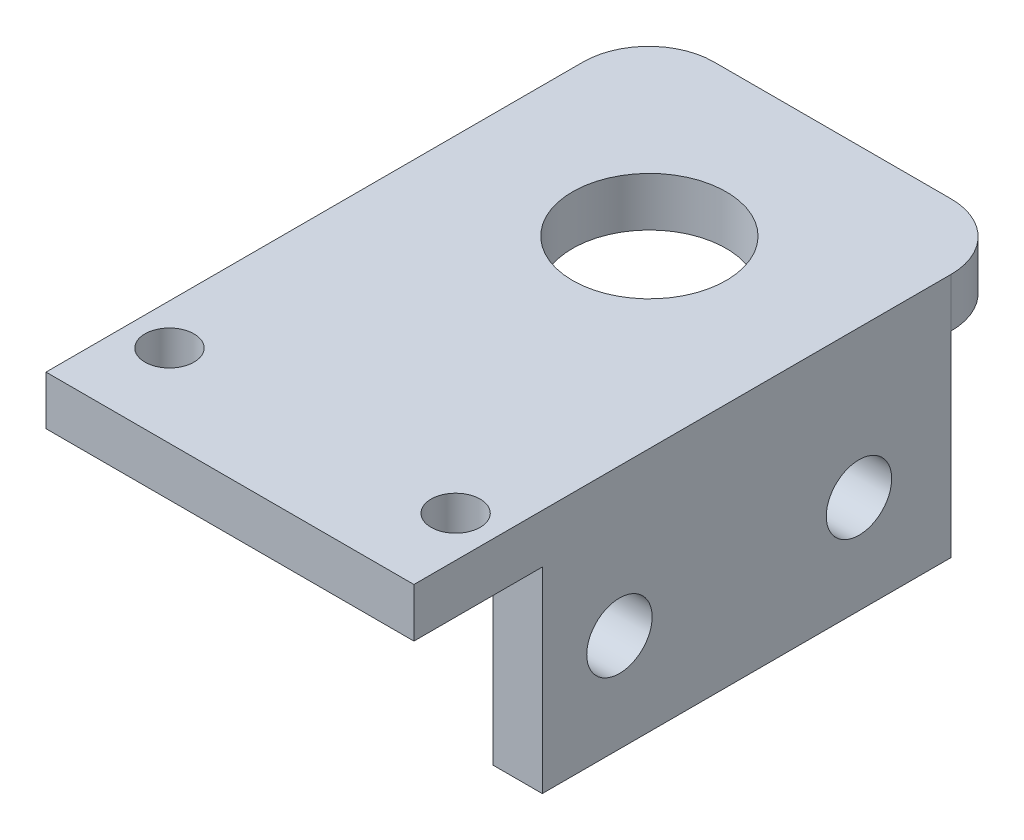
from build123d import *

# Parameters (mm, degrees)
SKETCH1_R           = 1.5
SKETCH1_R_2         = 4.7
BOSS_EXTRUDE1_DEPTH = 3
SKETCH2_W           = 25
SKETCH2_H           = 12
BOSS_EXTRUDE3_DEPTH = 3
SKETCH4_R           = 2
CUT_EXTRUDE2_DEPTH  = 31.33101416
BOSS_EXTRUDE4_DEPTH = 1.5


with BuildPart() as part:
    # Sketch1 → Boss-Extrude1 (new body)
    with BuildSketch(Plane(origin=(0, 0, 0), x_dir=(1, 0, 0), z_dir=(0, 1, 0))):
        with BuildLine():
            ThreePointArc((21.045480929, 12.95727721), (19.873908054, 15.785704335), (17.045480929, 16.95727721))
            Line((17.045480929, 16.95727721), (2.545480929, 16.95727721))
            ThreePointArc((2.545480929, 16.95727721), (-0.282946196, 15.785704335), (-1.454519071, 12.95727721))
            Line((-1.454519071, 12.95727721), (-1.454519071, -19.89272279))
            Line((-1.454519071, -19.89272279), (2.724413117, -19.89272279))
            Line((2.724413117, -19.89272279), (16.866548741, -19.89272279))
            Line((16.866548741, -19.89272279), (21.045480929, -19.89272279))
            Line((21.045480929, -19.89272279), (21.045480929, 12.95727721))
        make_face()
        with Locations(Location((1.045480929, -14.84272279, 0), (0, 0, 270))):
            Circle(SKETCH1_R, mode=Mode.SUBTRACT)
        with Locations(Location((18.545480929, -14.84272279, 0), (0, 0, 270))):
            Circle(SKETCH1_R, mode=Mode.SUBTRACT)
        with Locations(Location((9.795480929, 5.75727721, 0), (0, 0, 270))):
            Circle(SKETCH1_R_2, mode=Mode.SUBTRACT)
    extrude(amount=BOSS_EXTRUDE1_DEPTH)

    # Sketch2 → Boss-Extrude3 (add)
    with BuildSketch(Plane(origin=(21.045480929, 0, 0), x_dir=(0, 0, -1), z_dir=(1, 0, 0))):
        with Locations((0.45727721, -6)):
            Rectangle(SKETCH2_W, SKETCH2_H)
    extrude(amount=-BOSS_EXTRUDE3_DEPTH)

    # Sketch4 → Cut-Extrude2 (cut, through all)
    with BuildSketch(Plane.ZY.offset(-18.045480929)):
        with Locations((7.324019086, -6)):
            Circle(SKETCH4_R)
        with Locations((-7.324019086, -6)):
            Circle(SKETCH4_R)
    extrude(amount=-CUT_EXTRUDE2_DEPTH, mode=Mode.SUBTRACT)

    # Sketch5 → Boss-Extrude4 (add, symmetric)
    with BuildSketch(Plane.XY.offset(2.04272279)):
        Polygon((18.045480929, -4.641213544), (11.011197959, 0), (18.045480929, 0), align=None)
    extrude(amount=BOSS_EXTRUDE4_DEPTH, both=True)


solid = part.part
